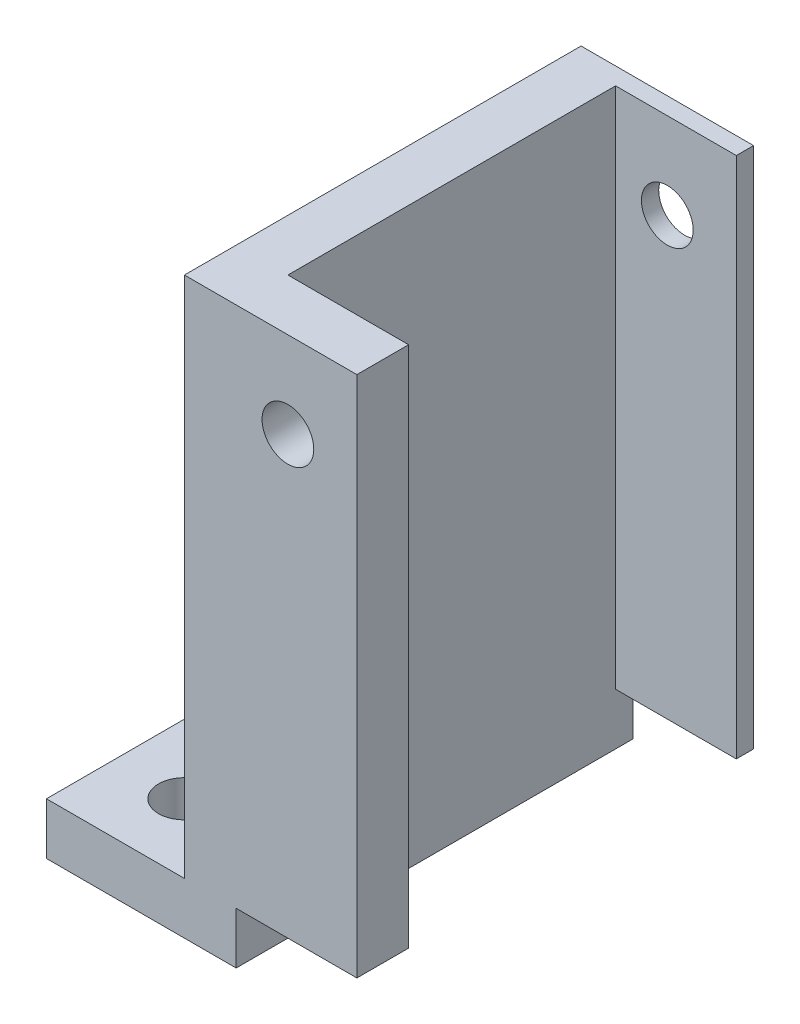
from build123d import *

# Parameters (mm, degrees)
CROQUIS1_W              = 23
CROQUIS1_H              = 30.3
SALIENTE_EXTRUIR2_DEPTH = 10
CROQUIS3_W              = 7
CROQUIS3_H              = 19
CORTAR_EXTRUIR1_DEPTH   = 40.333064971
CROQUIS4_W              = 11
CROQUIS4_H              = 23
SALIENTE_EXTRUIR3_DEPTH = 3
CROQUIS5_R              = 1.5
CORTAR_EXTRUIR3_DEPTH   = 40.333064971
CROQUIS6_R              = 1.5
CORTAR_EXTRUIR4_DEPTH   = 42.688007868
NERVIO1_REACH           = 38.622
CROQUIS8_WALL_W         = 82.243156676
CROQUIS8_WALL_H         = 7


with BuildPart() as part:
    # Croquis1 → Saliente-Extruir2 (new body)
    with BuildSketch(Plane(origin=(0, 0, 0), x_dir=(0, 0, -1), z_dir=(1, 0, 0))):
        with Locations((-11.5, -15.15)):
            Rectangle(CROQUIS1_W, CROQUIS1_H)
    extrude(amount=SALIENTE_EXTRUIR2_DEPTH)

    # Croquis3 → Cortar-Extruir1 (cut, through all)
    with BuildSketch(Plane(origin=(0, 0, 0), x_dir=(1, 0, 0), z_dir=(0, 1, 0))):
        with Locations((6.5, -10.5)):
            Rectangle(CROQUIS3_W, CROQUIS3_H)
    extrude(amount=-CORTAR_EXTRUIR1_DEPTH, mode=Mode.SUBTRACT)

    # Croquis4 → Saliente-Extruir3 (add)
    with BuildSketch(Plane.XZ.offset(30.3)):
        with Locations((-2.5, 11.5)):
            Rectangle(CROQUIS4_W, CROQUIS4_H)
    extrude(amount=SALIENTE_EXTRUIR3_DEPTH)

    # Croquis5 → Cortar-Extruir3 (cut, through all)
    with BuildSketch(Plane(origin=(0, -30.3, 0), x_dir=(1, 0, 0), z_dir=(0, 1, 0))):
        with Locations(Location((-4, -4, 0), (0, 0, 270))):
            Circle(CROQUIS5_R)
        with Locations(Location((-4, -19, 0), (0, 0, 270))):
            Circle(CROQUIS5_R)
    extrude(amount=-CORTAR_EXTRUIR3_DEPTH, mode=Mode.SUBTRACT)

    # Croquis6 → Cortar-Extruir4 (cut, through all)
    with BuildSketch(Plane.XY.offset(23)):
        with Locations(Location((6, -5, 0), (0, 0, 270))):
            Circle(CROQUIS6_R)
    extrude(amount=-CORTAR_EXTRUIR4_DEPTH, mode=Mode.SUBTRACT)

    # Croquis8 wall → Nervio1 (add, up to next)
    with BuildSketch(Plane(origin=(-2.474873734, -27.825126266, 11.5), x_dir=(0.707106781187, 0.707106781187, 0), z_dir=(-0.707106781187, 0.707106781187, 0)), mode=Mode.PRIVATE) as nervio1_sk1:
        Rectangle(CROQUIS8_WALL_W, CROQUIS8_WALL_H)
    nervio1_tool1 = extrude(nervio1_sk1.sketch, amount=-NERVIO1_REACH, mode=Mode.PRIVATE) - part.part
    add(nervio1_tool1.solids().sort_by_distance((-2.474873734, -27.825126266, 11.5))[0])


solid = part.part
